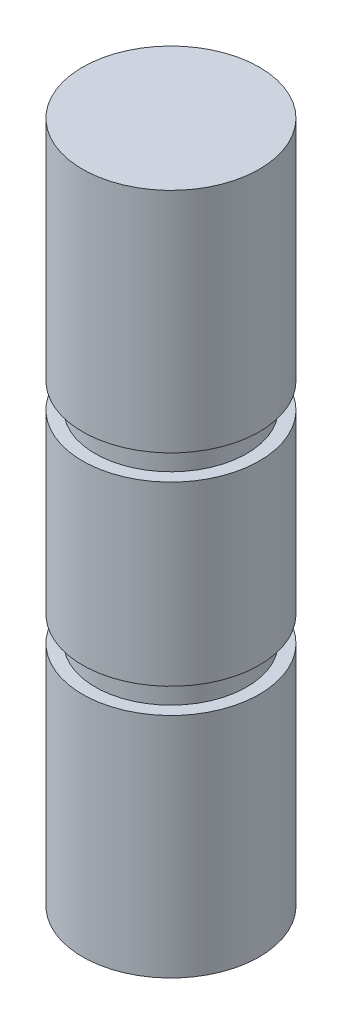
from build123d import *


with BuildPart() as part:
    # 草图1 → 旋转1 (revolve)
    with BuildSketch(Plane(origin=(0, 0, 0), x_dir=(0, 0, -1), z_dir=(1, 0, 0))):
        Polygon((0, 13.5), (3.5, 13.5), (3.5, 4.5), (3, 4.5), (3, 3.5), (3.5, 3.5), (3.5, -3.5), (3, -3.5), (3, -4.5), (3.5, -4.5), (3.5, -13.5), (0, -13.5), align=None)
    revolve(axis=Axis((0, -13.5, 0), (0, 1, 0)))


solid = part.part
